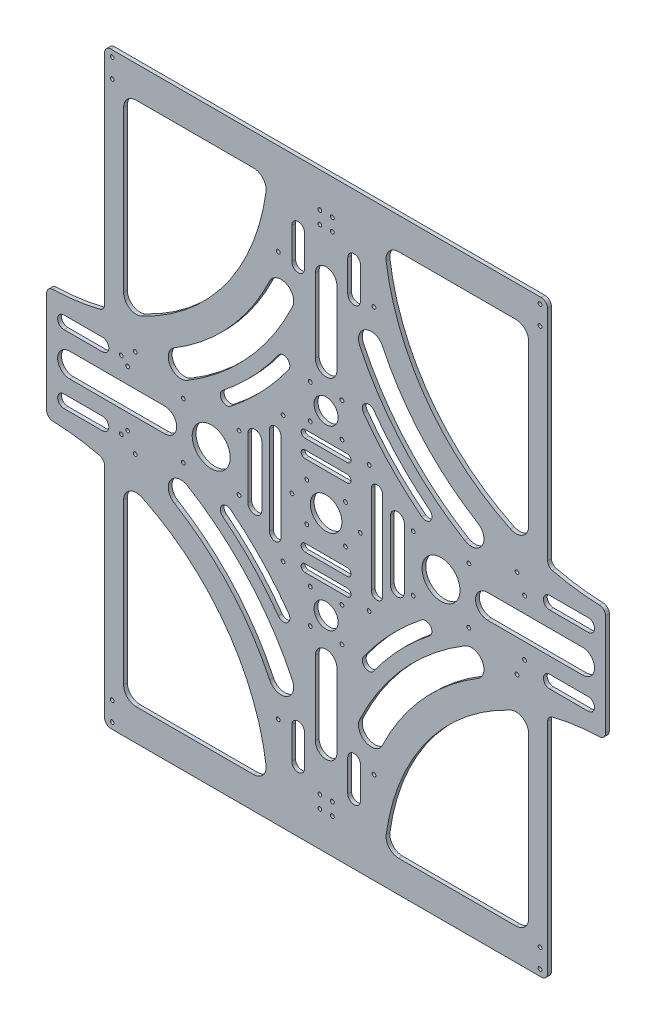
from build123d import *

# Parameters (mm, degrees)
EXTRUDE_1_DEPTH     = 3
SKETCH_3_R          = 1.5
SKETCH_3_R_2        = 12.5
SKETCH_3_R_3        = 9.5
SKETCH_3_R_4        = 15
CUT_EXTRUDE_1_DEPTH = 3
FILLET_1_R          = 10
FILLET_2_R          = 5
FILLET_3_R          = 5


with BuildPart() as part:
    # 草图1 → 凸台-拉伸1 (new body)
    with BuildSketch(Plane.XY):
        with BuildLine():
            Line((-44.140516271, -45), (-44.140516271, 45))
            ThreePointArc((-44.140516271, 45), (-21.038327074, 46.531591192), (1.659483729, 51.099555951))
            Line((1.659483729, 51.099555951), (1.659483729, 207.5))
            Line((1.659483729, 207.5), (1.659483729, 232.5))
            Line((1.659483729, 232.5), (351.659483729, 232.5))
            Line((351.659483729, 232.5), (351.659483729, 207.5))
            Line((351.659483729, 207.5), (351.659483729, 51.099555951))
            ThreePointArc((351.659483729, 51.099555951), (374.357294532, 46.531591192), (397.459483729, 45))
            Line((397.459483729, 45), (397.459483729, -45))
            ThreePointArc((397.459483729, -45), (374.357294532, -46.531591192), (351.659483729, -51.099555951))
            Line((351.659483729, -51.099555951), (351.659483729, -207.5))
            Line((351.659483729, -207.5), (351.659483729, -232.5))
            Line((351.659483729, -232.5), (1.659483729, -232.5))
            Line((1.659483729, -232.5), (1.659483729, -207.5))
            Line((1.659483729, -207.5), (1.659483729, -51.099555951))
            ThreePointArc((1.659483729, -51.099555951), (-21.038327074, -46.531591192), (-44.140516271, -45))
        make_face()
        with BuildLine():
            Line((336.659483729, 207.5), (222.906483182, 207.5))
            ThreePointArc((222.906483182, 207.5), (257.483432969, 114.968075263), (336.659483729, 55.901371121))
            Line((336.659483729, 55.901371121), (336.659483729, 207.5))
        make_face(mode=Mode.SUBTRACT)
        with BuildLine():
            Line((130.412484276, 207.5), (16.659483729, 207.5))
            Line((16.659483729, 207.5), (16.659483729, 55.901371121))
            ThreePointArc((16.659483729, 55.901371121), (95.835534488, 114.968075263), (130.412484276, 207.5))
        make_face(mode=Mode.SUBTRACT)
        with BuildLine():
            Line((130.412484276, -207.5), (16.659483729, -207.5))
            Line((16.659483729, -207.5), (16.659483729, -55.901371121))
            ThreePointArc((16.659483729, -55.901371121), (95.835534488, -114.968075263), (130.412484276, -207.5))
        make_face(mode=Mode.SUBTRACT)
        with BuildLine():
            Line((336.659483729, -207.5), (336.659483729, -55.901371121))
            ThreePointArc((336.659483729, -55.901371121), (257.483432969, -114.968075263), (222.906483182, -207.5))
            Line((222.906483182, -207.5), (336.659483729, -207.5))
        make_face(mode=Mode.SUBTRACT)
    extrude(amount=EXTRUDE_1_DEPTH)

    # 草图3 → 切除-拉伸1 (cut)
    with BuildSketch(Plane.XY.offset(3)):
        with Locations((142.659483729, 50)):
            Circle(SKETCH_3_R)
        with Locations((210.659483729, 50)):
            Circle(SKETCH_3_R)
        with Locations((142.659483729, -50)):
            Circle(SKETCH_3_R)
        with Locations((210.659483729, -50)):
            Circle(SKETCH_3_R)
        with Locations((161.409483729, 15.25)):
            Circle(SKETCH_3_R)
        with Locations((191.909483729, 15.25)):
            Circle(SKETCH_3_R)
        with Locations((191.909483729, -15.25)):
            Circle(SKETCH_3_R)
        with Locations((161.409483729, -15.25)):
            Circle(SKETCH_3_R)
        with Locations((289.459483729, 22)):
            Circle(SKETCH_3_R)
        with Locations((245.459483729, 22)):
            Circle(SKETCH_3_R)
        with Locations((289.459483729, -22)):
            Circle(SKETCH_3_R)
        with Locations((245.459483729, -22)):
            Circle(SKETCH_3_R)
        with Locations((333.459483729, 22)):
            Circle(SKETCH_3_R)
        with Locations((333.459483729, -22)):
            Circle(SKETCH_3_R)
        with Locations(Location((19.859483729, -22, 0), (0, 0, 180))):
            Circle(SKETCH_3_R)
        with Locations(Location((19.859483729, 22, 0), (0, 0, 180))):
            Circle(SKETCH_3_R)
        with Locations(Location((63.859483729, 22, 0), (0, 0, 180))):
            Circle(SKETCH_3_R)
        with Locations(Location((63.859483729, -22, 0), (0, 0, 180))):
            Circle(SKETCH_3_R)
        with Locations(Location((107.859483729, -22, 0), (0, 0, 180))):
            Circle(SKETCH_3_R)
        with Locations(Location((107.859483729, 22, 0), (0, 0, 180))):
            Circle(SKETCH_3_R)
        with Locations((164.159483729, 83.5)):
            Circle(SKETCH_3_R)
        with Locations((189.159483729, 83.5)):
            Circle(SKETCH_3_R)
        with Locations((164.159483729, 56.5)):
            Circle(SKETCH_3_R)
        with Locations((189.159483729, 56.5)):
            Circle(SKETCH_3_R)
        with Locations(Location((164.159483729, -56.5, 0), (0, 0, 180))):
            Circle(SKETCH_3_R)
        with Locations(Location((189.159483729, -56.5, 0), (0, 0, 180))):
            Circle(SKETCH_3_R)
        with Locations(Location((189.159483729, -83.5, 0), (0, 0, 180))):
            Circle(SKETCH_3_R)
        with Locations(Location((164.159483729, -83.5, 0), (0, 0, 180))):
            Circle(SKETCH_3_R)
        with Locations((181.609231197, 204.849747468)):
            Circle(SKETCH_3_R)
        with Locations((171.70973626, 204.849747468)):
            Circle(SKETCH_3_R)
        with Locations((171.70973626, 194.950252532)):
            Circle(SKETCH_3_R)
        with Locations((181.609231197, 194.950252532)):
            Circle(SKETCH_3_R)
        with Locations(Location((181.609231197, -194.950252532, 0), (0, 0, 180))):
            Circle(SKETCH_3_R)
        with Locations(Location((171.70973626, -194.950252532, 0), (0, 0, 180))):
            Circle(SKETCH_3_R)
        with Locations(Location((181.609231197, -204.849747468, 0), (0, 0, 180))):
            Circle(SKETCH_3_R)
        with Locations(Location((171.70973626, -204.849747468, 0), (0, 0, 180))):
            Circle(SKETCH_3_R)
        with Locations((7.659483729, 227.5)):
            Circle(SKETCH_3_R)
        with Locations((7.659483729, 212.5)):
            Circle(SKETCH_3_R)
        with Locations(Location((345.659483729, 212.5, 0), (0, 0, 180))):
            Circle(SKETCH_3_R)
        with Locations(Location((345.659483729, 227.5, 0), (0, 0, 180))):
            Circle(SKETCH_3_R)
        with Locations((345.659483729, -212.5)):
            Circle(SKETCH_3_R)
        with Locations((345.659483729, -227.5)):
            Circle(SKETCH_3_R)
        with Locations(Location((7.659483729, -212.5, 0), (0, 0, 180))):
            Circle(SKETCH_3_R)
        with Locations(Location((7.659483729, -227.5, 0), (0, 0, 180))):
            Circle(SKETCH_3_R)
        with Locations((214.459483729, 160)):
            Circle(SKETCH_3_R)
        with Locations(Location((138.859483729, 160, 0), (0, 0, 180))):
            Circle(SKETCH_3_R)
        with Locations(Location((214.459483729, -160, 0), (0, 0, 180))):
            Circle(SKETCH_3_R)
        with Locations((138.859483729, -160)):
            Circle(SKETCH_3_R)
        with Locations((327.459483729, 35)):
            Circle(SKETCH_3_R)
        with Locations(Location((327.459483729, -35, 0), (0, 0, 180))):
            Circle(SKETCH_3_R)
        with Locations((25.859483729, -35)):
            Circle(SKETCH_3_R)
        with Locations(Location((25.859483729, 35, 0), (0, 0, 180))):
            Circle(SKETCH_3_R)
        with Locations((14.859483729, 27)):
            Circle(SKETCH_3_R)
        with Locations(Location((14.859483729, -27, 0), (0, 0, 180))):
            Circle(SKETCH_3_R)
        with Locations((176.659483729, 0)):
            Circle(SKETCH_3_R_2)
        with Locations((176.659483729, 70)):
            Circle(SKETCH_3_R_3)
        with Locations(Location((176.659483729, -70, 0), (0, 0, 180))):
            Circle(SKETCH_3_R_3)
        with Locations((267.459483729, 0)):
            Circle(SKETCH_3_R_4)
        with Locations(Location((85.859483729, 0, 0), (0, 0, 180))):
            Circle(SKETCH_3_R_4)
        with Locations((149.659483729, 0)):
            Circle(SKETCH_3_R)
        with Locations(Location((203.659483729, 0, 0), (0, 0, 180))):
            Circle(SKETCH_3_R)
        with BuildLine():
            Line((159.949956486, 34.939229343), (193.369010971, 34.939229343))
            ThreePointArc((193.369010971, 34.939229343), (196.369010971, 31.939229343), (193.369010971, 28.939229343))
            Line((193.369010971, 28.939229343), (159.949956486, 28.939229343))
            ThreePointArc((159.949956486, 28.939229343), (156.949956486, 31.939229343), (159.949956486, 34.939229343))
        make_face()
        with BuildLine():
            Line((159.949956486, 42.939229343), (193.369010971, 42.939229343))
            ThreePointArc((193.369010971, 42.939229343), (196.369010971, 45.939229343), (193.369010971, 48.939229343))
            Line((193.369010971, 48.939229343), (159.949956486, 48.939229343))
            ThreePointArc((159.949956486, 48.939229343), (156.949956486, 45.939229343), (159.949956486, 42.939229343))
        make_face()
        with BuildLine():
            Line((159.949956486, -34.939229343), (193.369010971, -34.939229343))
            ThreePointArc((193.369010971, -34.939229343), (196.369010971, -31.939229343), (193.369010971, -28.939229343))
            Line((193.369010971, -28.939229343), (159.949956486, -28.939229343))
            ThreePointArc((159.949956486, -28.939229343), (156.949956486, -31.939229343), (159.949956486, -34.939229343))
        make_face()
        with BuildLine():
            Line((159.949956486, -48.939229343), (193.369010971, -48.939229343))
            ThreePointArc((193.369010971, -48.939229343), (196.369010971, -45.939229343), (193.369010971, -42.939229343))
            Line((193.369010971, -42.939229343), (159.949956486, -42.939229343))
            ThreePointArc((159.949956486, -42.939229343), (156.949956486, -45.939229343), (159.949956486, -48.939229343))
        make_face()
        with BuildLine():
            Line((238.476710645, 23.650147082), (238.476710645, -23.650147082))
            ThreePointArc((238.476710645, -23.650147082), (232.969034852, -29.157822875), (227.461359058, -23.650147082))
            Line((227.461359058, -23.650147082), (227.461359058, 23.650147082))
            ThreePointArc((227.461359058, 23.650147082), (232.969034852, 29.157822875), (238.476710645, 23.650147082))
        make_face()
        with BuildLine():
            Line((114.842256813, 23.650147082), (114.842256813, -23.650147082))
            ThreePointArc((114.842256813, -23.650147082), (120.349932606, -29.157822875), (125.857608399, -23.650147082))
            Line((125.857608399, -23.650147082), (125.857608399, 23.650147082))
            ThreePointArc((125.857608399, 23.650147082), (120.349932606, 29.157822875), (114.842256813, 23.650147082))
        make_face()
        with BuildLine():
            Line((168.159483729, 101.690113047), (168.159483729, 160))
            ThreePointArc((168.159483729, 160), (176.659483729, 168.5), (185.159483729, 160))
            Line((185.159483729, 160), (185.159483729, 101.690113047))
            ThreePointArc((185.159483729, 101.690113047), (176.659483729, 93.190113047), (168.159483729, 101.690113047))
        make_face()
        with BuildLine():
            Line((168.159483729, -101.690113047), (168.159483729, -160))
            ThreePointArc((168.159483729, -160), (176.659483729, -168.5), (185.159483729, -160))
            Line((185.159483729, -160), (185.159483729, -101.690113047))
            ThreePointArc((185.159483729, -101.690113047), (176.659483729, -93.190113047), (168.159483729, -101.690113047))
        make_face()
        with BuildLine():
            Line((379.247060888, -9.5), (304.247060888, -9.5))
            ThreePointArc((304.247060888, -9.5), (294.747060888, 0), (304.247060888, 9.5))
            Line((304.247060888, 9.5), (379.247060888, 9.5))
            ThreePointArc((379.247060888, 9.5), (388.747060888, 0), (379.247060888, -9.5))
        make_face()
        with BuildLine():
            Line((-25.92809343, -9.5), (49.07190657, -9.5))
            ThreePointArc((49.07190657, -9.5), (58.57190657, 0), (49.07190657, 9.5))
            Line((49.07190657, 9.5), (-25.92809343, 9.5))
            ThreePointArc((-25.92809343, 9.5), (-35.42809343, 0), (-25.92809343, -9.5))
        make_face()
        with BuildLine():
            Line((212.387502182, -34.939229343), (212.387502182, 34.939229343))
            ThreePointArc((212.387502182, 34.939229343), (216.887502182, 39.439229343), (221.387502182, 34.939229343))
            Line((221.387502182, 34.939229343), (221.387502182, -34.939229343))
            ThreePointArc((221.387502182, -34.939229343), (216.887502182, -39.439229343), (212.387502182, -34.939229343))
        make_face()
        with BuildLine():
            Line((140.931465276, -34.939229343), (140.931465276, 34.939229343))
            ThreePointArc((140.931465276, 34.939229343), (136.431465276, 39.439229343), (131.931465276, 34.939229343))
            Line((131.931465276, 34.939229343), (131.931465276, -34.939229343))
            ThreePointArc((131.931465276, -34.939229343), (136.431465276, -39.439229343), (140.931465276, -34.939229343))
        make_face()
        with BuildLine():
            Line((-30.430191909, 32), (0, 32))
            ThreePointArc((0, 32), (5, 27), (0, 22))
            Line((0, 22), (-30.430191909, 22))
            ThreePointArc((-30.430191909, 22), (-35.430191909, 27), (-30.430191909, 32))
        make_face()
        with BuildLine():
            Line((-30.430191909, -32), (0, -32))
            ThreePointArc((0, -32), (5, -27), (0, -22))
            Line((0, -22), (-30.430191909, -22))
            ThreePointArc((-30.430191909, -22), (-35.430191909, -27), (-30.430191909, -32))
        make_face()
        with BuildLine():
            Line((383.749159366, -32), (353.318967457, -32))
            ThreePointArc((353.318967457, -32), (348.318967457, -27), (353.318967457, -22))
            Line((353.318967457, -22), (383.749159366, -22))
            ThreePointArc((383.749159366, -22), (388.749159366, -27), (383.749159366, -32))
        make_face()
        with BuildLine():
            Line((383.749159366, 32), (353.318967457, 32))
            ThreePointArc((353.318967457, 32), (348.318967457, 27), (353.318967457, 22))
            Line((353.318967457, 22), (383.749159366, 22))
            ThreePointArc((383.749159366, 22), (388.749159366, 27), (383.749159366, 32))
        make_face()
        with BuildLine():
            Line((149.558772964, 158.415992951), (149.558772964, 183.44946673))
            ThreePointArc((149.558772964, 183.44946673), (154.558772964, 188.44946673), (159.558772964, 183.44946673))
            Line((159.558772964, 183.44946673), (159.558772964, 158.415992951))
            ThreePointArc((159.558772964, 158.415992951), (154.558772964, 153.415992951), (149.558772964, 158.415992951))
        make_face()
        with BuildLine():
            Line((203.760194494, 158.415992951), (203.760194494, 183.44946673))
            ThreePointArc((203.760194494, 183.44946673), (198.760194494, 188.44946673), (193.760194494, 183.44946673))
            Line((193.760194494, 183.44946673), (193.760194494, 158.415992951))
            ThreePointArc((193.760194494, 158.415992951), (198.760194494, 153.415992951), (203.760194494, 158.415992951))
        make_face()
        with BuildLine():
            Line((203.760194494, -158.415992951), (203.760194494, -183.44946673))
            ThreePointArc((203.760194494, -183.44946673), (198.760194494, -188.44946673), (193.760194494, -183.44946673))
            Line((193.760194494, -183.44946673), (193.760194494, -158.415992951))
            ThreePointArc((193.760194494, -158.415992951), (198.760194494, -153.415992951), (203.760194494, -158.415992951))
        make_face()
        with BuildLine():
            Line((149.558772964, -158.415992951), (149.558772964, -183.44946673))
            ThreePointArc((149.558772964, -183.44946673), (154.558772964, -188.44946673), (159.558772964, -183.44946673))
            Line((159.558772964, -183.44946673), (159.558772964, -158.415992951))
            ThreePointArc((159.558772964, -158.415992951), (154.558772964, -153.415992951), (149.558772964, -158.415992951))
        make_face()
        with BuildLine():
            ThreePointArc((150.098251641, -127.824618038), (115.360496313, -75.831948808), (67.131321357, -36.033758122))
            ThreePointArc((67.131321357, -36.033758122), (53.399317659, -39.414893203), (56.78045274, -53.146896901))
            ThreePointArc((56.78045274, -53.146896901), (100.523192817, -89.242930314), (132.029529045, -136.399072174))
            ThreePointArc((132.029529045, -136.399072174), (145.351117411, -141.146206405), (150.098251641, -127.824618038))
        make_face()
        with BuildLine():
            ThreePointArc((203.220715816, -127.824618038), (237.958471144, -75.831948808), (286.1876461, -36.033758122))
            ThreePointArc((286.1876461, -36.033758122), (299.919649798, -39.414893203), (296.538514717, -53.146896901))
            ThreePointArc((296.538514717, -53.146896901), (252.79577464, -89.242930314), (221.289438412, -136.399072174))
            ThreePointArc((221.289438412, -136.399072174), (207.967850046, -141.146206405), (203.220715816, -127.824618038))
        make_face()
        with BuildLine():
            ThreePointArc((203.220715816, 127.824618038), (237.958471144, 75.831948808), (286.1876461, 36.033758122))
            ThreePointArc((286.1876461, 36.033758122), (299.919649798, 39.414893203), (296.538514717, 53.146896901))
            ThreePointArc((296.538514717, 53.146896901), (252.79577464, 89.242930314), (221.289438412, 136.399072174))
            ThreePointArc((221.289438412, 136.399072174), (207.967850046, 141.146206405), (203.220715816, 127.824618038))
        make_face()
        with BuildLine():
            ThreePointArc((150.098251641, 127.824618038), (115.360496313, 75.831948808), (67.131321357, 36.033758122))
            ThreePointArc((67.131321357, 36.033758122), (53.399317659, 39.414893203), (56.78045274, 53.146896901))
            ThreePointArc((56.78045274, 53.146896901), (100.523192817, 89.242930314), (132.029529045, 136.399072174))
            ThreePointArc((132.029529045, 136.399072174), (145.351117411, 141.146206405), (150.098251641, 127.824618038))
        make_face()
        with BuildLine():
            ThreePointArc((147.087050651, -83.409306141), (125.829180257, -57.718447561), (101.149087306, -35.29501606))
            ThreePointArc((101.149087306, -35.29501606), (94.127925869, -36.133641174), (94.966550983, -43.15480261))
            ThreePointArc((94.966550983, -43.15480261), (118.596427213, -64.624045537), (138.949707378, -89.221676093))
            ThreePointArc((138.949707378, -89.221676093), (145.924563991, -90.384162754), (147.087050651, -83.409306141))
        make_face()
        with BuildLine():
            ThreePointArc((206.231916806, -83.409306141), (227.489787201, -57.718447561), (252.169880152, -35.29501606))
            ThreePointArc((252.169880152, -35.29501606), (259.191041588, -36.133641174), (258.352416474, -43.15480261))
            ThreePointArc((258.352416474, -43.15480261), (234.722540244, -64.624045537), (214.369260079, -89.221676093))
            ThreePointArc((214.369260079, -89.221676093), (207.394403467, -90.384162754), (206.231916806, -83.409306141))
        make_face()
        with BuildLine():
            ThreePointArc((206.231916806, 83.409306141), (227.489787201, 57.718447561), (252.169880152, 35.29501606))
            ThreePointArc((252.169880152, 35.29501606), (259.191041588, 36.133641174), (258.352416474, 43.15480261))
            ThreePointArc((258.352416474, 43.15480261), (234.722540244, 64.624045537), (214.369260079, 89.221676093))
            ThreePointArc((214.369260079, 89.221676093), (207.394403467, 90.384162754), (206.231916806, 83.409306141))
        make_face()
        with BuildLine():
            ThreePointArc((147.087050651, 83.409306141), (125.829180257, 57.718447561), (101.149087306, 35.29501606))
            ThreePointArc((101.149087306, 35.29501606), (94.127925869, 36.133641174), (94.966550983, 43.15480261))
            ThreePointArc((94.966550983, 43.15480261), (118.596427213, 64.624045537), (138.949707378, 89.221676093))
            ThreePointArc((138.949707378, 89.221676093), (145.924563991, 90.384162754), (147.087050651, 83.409306141))
        make_face()
    extrude(amount=-CUT_EXTRUDE_1_DEPTH, mode=Mode.SUBTRACT)

    # 圆角1
    fillet_1_edges = [part.edges().sort_by_distance(p)[0] for p in [
        (222.906483182, 207.5, 1.5),
        (336.659483729, 55.901371121, 1.5),
        (336.659483729, 207.5, 1.5),
        (130.412484276, -207.5, 1.5),
        (16.659483729, -55.901371121, 1.5),
        (16.659483729, -207.5, 1.5),
        (16.659483729, 55.901371121, 1.5),
        (130.412484276, 207.5, 1.5),
        (16.659483729, 207.5, 1.5),
        (336.659483729, -55.901371121, 1.5),
        (222.906483182, -207.5, 1.5),
        (336.659483729, -207.5, 1.5),
    ]]
    fillet(fillet_1_edges, radius=FILLET_1_R)

    # 圆角2
    fillet_2_edges = [part.edges().sort_by_distance(p)[0] for p in [
        (1.659483729, 232.5, 1.5),
        (351.659483729, 232.5, 1.5),
        (397.459483729, 45, 1.5),
        (397.459483729, -45, 1.5),
        (351.659483729, -232.5, 1.5),
        (1.659483729, -232.5, 1.5),
        (-44.140516271, -45, 1.5),
        (-44.140516271, 45, 1.5),
    ]]
    fillet(fillet_2_edges, radius=FILLET_2_R)

    # 圆角3
    fillet_3_edges = [part.edges().sort_by_distance(p)[0] for p in [
        (1.659483729, 51.099555951, 1.5),
        (351.659483729, 51.099555951, 1.5),
        (351.659483729, -51.099555951, 1.5),
        (1.659483729, -51.099555951, 1.5),
    ]]
    fillet(fillet_3_edges, radius=FILLET_3_R)


solid = part.part
